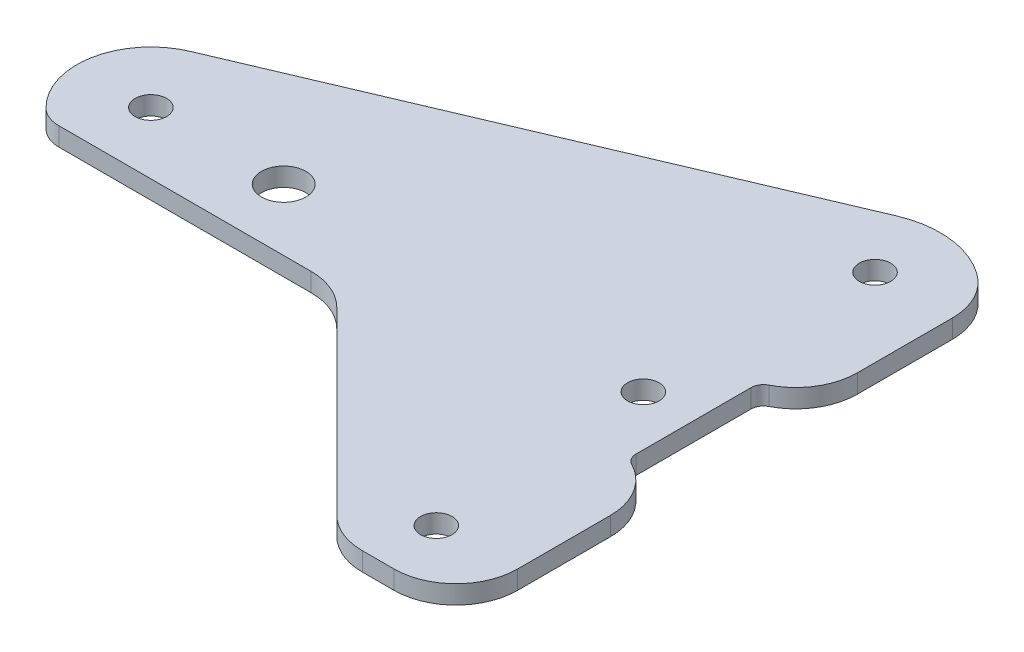
from build123d import *

# Parameters (mm, degrees)
CROQUIS1_R              = 2.55
CROQUIS1_R_2            = 3.6
SALIENTE_EXTRUIR1_DEPTH = 3
SALIENTE_EXTRUIR2_START = -3
CROQUIS2_R              = 2.55
SALIENTE_EXTRUIR2_DEPTH = 3
CROQUIS3_R              = 2.55
CORTAR_EXTRUIR1_DEPTH   = 241.986057114


with BuildPart() as part:
    # Croquis1 → Saliente-Extruir1 (new body)
    with BuildSketch(Plane.XZ.offset(-67.665218204)):
        with BuildLine():
            Line((164.350600539, 56.877055872), (123.508632223, 56.877055872))
            ThreePointArc((123.508632223, 56.877055872), (121.618809858, 56.50615637), (120.009361162, 55.448484443))
            ThreePointArc((120.009361162, 55.448484443), (116.616013433, 44.650352004), (123.71346014, 35.833282013))
            Line((123.71346014, 35.833282013), (203.945738541, 1.73058484))
            ThreePointArc((203.945738541, 1.73058484), (211.421784271, 0.621778432), (218.48951687, 3.299065734))
            Line((218.48951687, 3.299065734), (218.548253693, 3.340713008))
            ThreePointArc((218.548253693, 3.340713008), (221.647904046, 6.906940108), (222.764194447, 11.498203962))
            Line((222.764194447, 11.498203962), (222.764194447, 26.877055872))
            ThreePointArc((222.764194447, 26.877055872), (221.296391093, 32.092573142), (217.323870368, 35.777019663))
            ThreePointArc((217.323870368, 35.777019663), (216.529366223, 36.513908968), (216.235805552, 37.557012422))
            Line((216.235805552, 37.557012422), (216.235805552, 56.197099321))
            ThreePointArc((216.235805552, 56.197099321), (216.529366223, 57.240202775), (217.323870368, 57.97709208))
            ThreePointArc((217.323870368, 57.97709208), (221.296391093, 61.661538601), (222.764194447, 66.877055872))
            Line((222.764194447, 66.877055872), (222.764194447, 81.877055872))
            ThreePointArc((222.764194447, 81.877055872), (219.835262259, 88.948123683), (212.764194447, 91.877055872))
            Line((212.764194447, 91.877055872), (207.634871786, 91.877055872))
            ThreePointArc((207.634871786, 91.877055872), (203.808037463, 91.115851197), (200.563803975, 88.948123683))
            Line((200.563803975, 88.948123683), (171.421668351, 59.80598806))
            ThreePointArc((171.421668351, 59.80598806), (168.177434863, 57.638260546), (164.350600539, 56.877055872))
        make_face()
        with Locations(Location((210.1, 82.377055872, 0), (0, 0, 90))):
            Circle(CROQUIS1_R, mode=Mode.SUBTRACT)
        with Locations(Location((210.1, 11.377055872, 0), (0, 0, 90))):
            Circle(CROQUIS1_R, mode=Mode.SUBTRACT)
        with Locations(Location((208.12, 46.877055872, 0), (0, 0, 90))):
            Circle(CROQUIS1_R, mode=Mode.SUBTRACT)
        with Locations(Location((149.9, 46.877055872, 0), (0, 0, 90))):
            Circle(CROQUIS1_R_2, mode=Mode.SUBTRACT)
        with Locations(Location((128.407611709, 46.877055872, 0), (0, 0, 90))):
            Circle(CROQUIS1_R, mode=Mode.SUBTRACT)
    extrude(amount=-SALIENTE_EXTRUIR1_DEPTH)

    # Croquis2 → Saliente-Extruir2 (add)
    with BuildSketch(Plane(origin=(0, 70.665218204, 0), x_dir=(-1, 0, 0), z_dir=(0, 1, 0)).offset(SALIENTE_EXTRUIR2_START)):
        with Locations((-208.12, 46.877055872)):
            Circle(CROQUIS2_R)
    extrude(amount=SALIENTE_EXTRUIR2_DEPTH)

    # Croquis3 → Cortar-Extruir1 (cut, through all)
    with BuildSketch(Plane(origin=(0, 70.665218204, 0), x_dir=(-1, 0, 0), z_dir=(0, 1, 0))):
        with Locations(Location((-208.107611709, 46.877055872, 0), (0, 0, 90))):
            Circle(CROQUIS3_R)
    extrude(amount=-CORTAR_EXTRUIR1_DEPTH, mode=Mode.SUBTRACT)


solid = part.part
